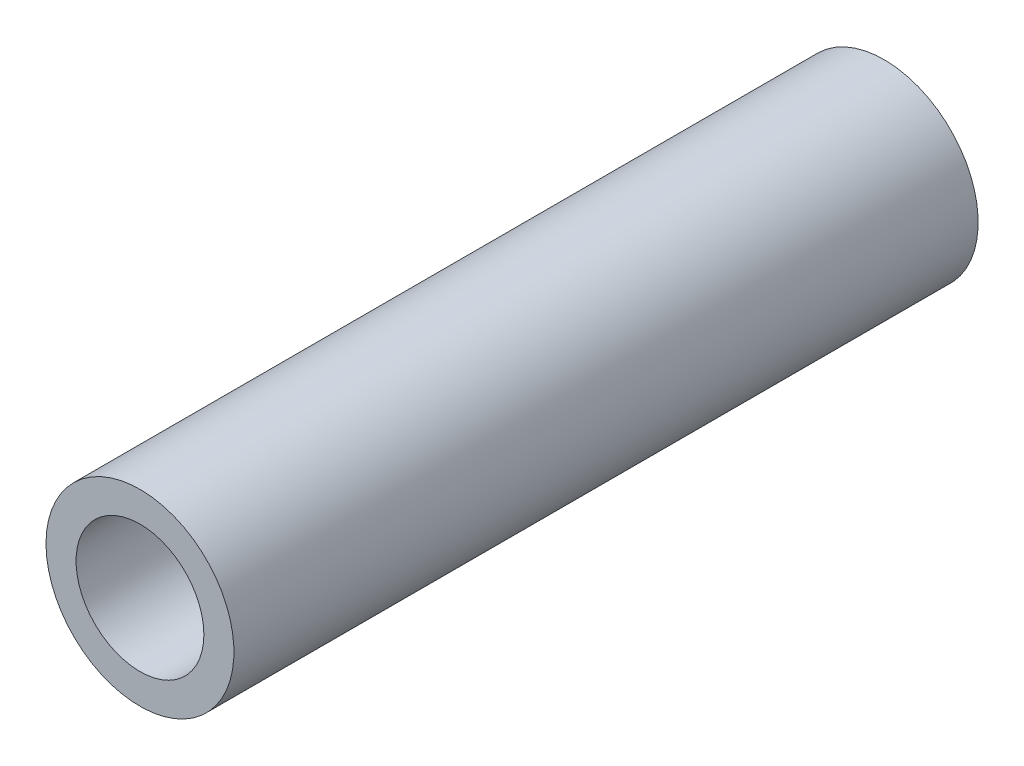
from build123d import *

# Parameters (mm, degrees)
SKETCH1_R               = 2.5
BOSS_EXTRUDE1_DEPTH     = 19.8
CUT_EXTRUDE1_DEPTH      = 21.113179759
CUT_EXTRUDE1_DEPTH_BACK = 21.113179759
SKETCH2_R               = 1.7


with BuildPart() as part:
    # Sketch1 → Boss-Extrude1 (new body)
    with BuildSketch(Plane(origin=(0, 0, 0), x_dir=(0, 1, 0), z_dir=(0, 0, 1))):
        with Locations(Location((0, 0, 0), (0, 0, 90))):
            Circle(SKETCH1_R)
    extrude(amount=BOSS_EXTRUDE1_DEPTH)

    # Sketch2 → Cut-Extrude1 (cut, two sides: drawn at the far end of the back side and taken through both)
    with BuildSketch(Plane.XY.offset(19.8).offset(-CUT_EXTRUDE1_DEPTH_BACK)):
        Circle(SKETCH2_R)
    extrude(amount=CUT_EXTRUDE1_DEPTH + CUT_EXTRUDE1_DEPTH_BACK, mode=Mode.SUBTRACT)


solid = part.part
